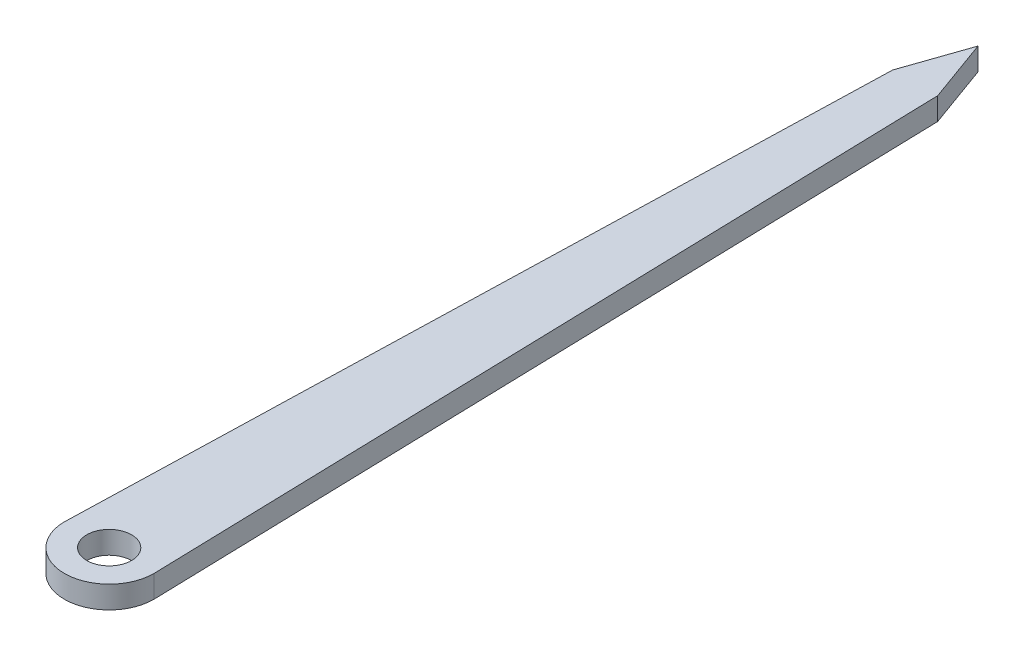
from build123d import *

# Parameters (mm, degrees)
SKICA1_R                = 2
P_IDAT_VYSUNUT_M3_DEPTH = 2


with BuildPart() as part:
    # Skica1 → Přidat vysunutím3 (new body)
    # profile 1 of 2: a face of its own
    with BuildSketch(Plane(origin=(0, 0, 0), x_dir=(1, 0, 0), z_dir=(0, 1, 0))):
        with BuildLine():
            Line((108.040914438, 105.971068272), (106.006427981, 34.226677149))
            ThreePointArc((106.006427981, 34.226677149), (110.004588085, 37.999997369), (113.994081517, 34.217515135))
            Line((113.994081517, 34.217515135), (112.040914438, 106))
            Line((112.040914438, 106), (110, 111.642221926))
            Line((110, 111.642221926), (108.040914438, 105.971068272))
        make_face()
    # profile 2 of 2: a face of its own
    with BuildSketch(Plane(origin=(0, 0, 0), x_dir=(1, 0, 0), z_dir=(0, 1, 0))):
        with BuildLine():
            ThreePointArc((106, 34), (107.171572875, 31.171572875), (110, 30))
            ThreePointArc((110, 30), (112.828427125, 31.171572875), (114, 34))
            Line((114, 34), (113.994081517, 34.217515135))
            ThreePointArc((113.994081517, 34.217515135), (110.004588085, 37.999997369), (106.006427981, 34.226677149))
            Line((106.006427981, 34.226677149), (106, 34))
        make_face()
        with Locations(Location((110, 34, 0), (0, 0, 270))):
            Circle(SKICA1_R, mode=Mode.SUBTRACT)
    extrude(amount=P_IDAT_VYSUNUT_M3_DEPTH)


solid = part.part
